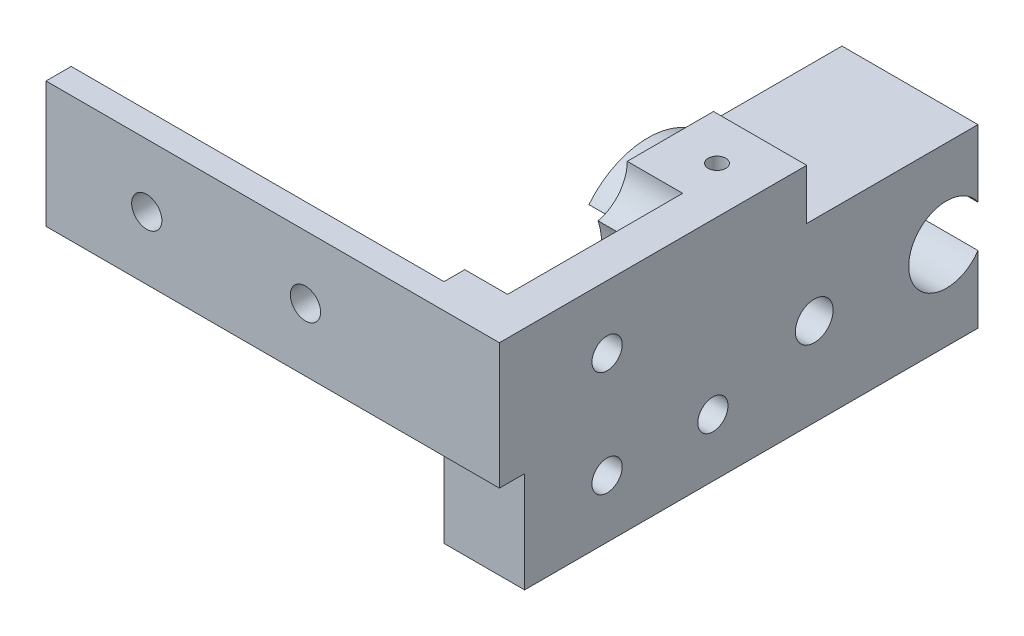
from build123d import *

# Parameters (mm, degrees)
SKETCH_1_W           = 18
SKETCH_1_H           = 9
EXTRUDE_1_DEPTH      = 8.3
SKETCH_1_12_R        = 3.5
CUT_EXTRUDE_1_DEPTH  = 6.8
SKETCH_1_14_R        = 3.5
CUT_EXTRUDE_2_DEPTH  = 5.1
SKETCH_1_15_R        = 3.5
CUT_EXTRUDE_3_DEPTH  = 3.4
SKETCH_1_16_R        = 4
CUT_EXTRUDE_4_DEPTH  = 1.7
CUT_EXTRUDE_5_DEPTH  = 5.1
CUT_EXTRUDE_6_DEPTH  = 2.9
CUT_EXTRUDE_7_DEPTH  = 1.2
SKETCH_3_W           = 5.4
SKETCH_3_H           = 6.8
CUT_EXTRUDE_8_DEPTH  = 2
SKETCH_1_19_R        = 1.5
CUT_EXTRUDE_9_DEPTH  = 6.8
CUT_EXTRUDE_10_DEPTH = 1.7
CUT_EXTRUDE_11_DEPTH = 1.2
CUT_EXTRUDE_START    = 0.5
CUT_EXTRUDE_13_DEPTH = 1.2
CUT_EXTRUDE_START_2  = 6.8
SKETCH_1_20_R        = 0.6
CUT_EXTRUDE_14_DEPTH = 15.969014677
CUT_EXTRUDE_START_3  = 1.7
SKETCH_1_21_R        = 0.75
SKETCH_1_21_R_2      = 0.6
CUT_EXTRUDE_15_DEPTH = 21.069014677
SKETCH_6_R           = 0.6
CUT_EXTRUDE_16_DEPTH = 22.179235114
SKETCH_6_3_R         = 1.5
CUT_EXTRUDE_17_DEPTH = 3.4
SKETCH_7_W           = 18
SKETCH_7_H           = 5
SKETCH_7_R           = 0.6
EXTRUDE_2_DEPTH      = 1
SKETCH_8_R           = 0.35
CUT_EXTRUDE_18_DEPTH = 2


with BuildPart() as part:
    # 草图1 → 凸台-拉伸1 (new body)
    with BuildSketch(Plane(origin=(0, 0, 0), x_dir=(0, 0, -1), z_dir=(1, 0, 0))):
        with Locations((-9, -4.5)):
            Rectangle(SKETCH_1_W, SKETCH_1_H)
    extrude(amount=EXTRUDE_1_DEPTH)

    # 草图1<12> → 切除-拉伸1 (cut)
    with BuildSketch(Plane(origin=(0, 0, 0), x_dir=(0, 0, -1), z_dir=(1, 0, 0))):
        with Locations((-14.724922359, -2.5)):
            Circle(SKETCH_1_12_R)
    extrude(amount=CUT_EXTRUDE_1_DEPTH, mode=Mode.SUBTRACT)

    # 草图1<14> → 切除-拉伸2 (cut)
    with BuildSketch(Plane(origin=(0, 0, 0), x_dir=(0, 0, -1), z_dir=(1, 0, 0))):
        with Locations((-14.724922359, -6.7)):
            Circle(SKETCH_1_14_R)
    extrude(amount=CUT_EXTRUDE_2_DEPTH, mode=Mode.SUBTRACT)

    # 草图1<15> → 切除-拉伸3 (cut)
    with BuildSketch(Plane(origin=(0, 0, 0), x_dir=(0, 0, -1), z_dir=(1, 0, 0))):
        with Locations((-10.524922359, -6.7)):
            Circle(SKETCH_1_15_R)
    extrude(amount=CUT_EXTRUDE_3_DEPTH, mode=Mode.SUBTRACT)

    # 草图1<16> → 切除-拉伸4 (cut)
    with BuildSketch(Plane(origin=(0, 0, 0), x_dir=(0, 0, -1), z_dir=(1, 0, 0))):
        with Locations((-6.5, -5.5)):
            Circle(SKETCH_1_16_R)
    extrude(amount=CUT_EXTRUDE_4_DEPTH, mode=Mode.SUBTRACT)

    # 草图1<17> → 切除-拉伸5 (cut)
    with BuildSketch(Plane(origin=(0, 0, 0), x_dir=(0, 0, -1), z_dir=(1, 0, 0))):
        with BuildLine():
            Line((-18, -9), (-17.363103551, -9))
            ThreePointArc((-17.363103551, -9), (-17.729170482, -8.495687395), (-18, -7.934449857))
            Line((-18, -7.934449857), (-18, -9))
        make_face()
        with BuildLine():
            ThreePointArc((-17.524922359, -4.6), (-17.793136229, -4.184061654), (-18, -3.734449857))
            Line((-18, -3.734449857), (-18, -5.465550143))
            ThreePointArc((-18, -5.465550143), (-17.793136229, -5.015938346), (-17.524922359, -4.6))
        make_face()
        with BuildLine():
            ThreePointArc((-18, -1.265550143), (-17.656316605, -0.58769046), (-17.174412102, 0))
            Line((-17.174412102, 0), (-18, 0))
            Line((-18, 0), (-18, -1.265550143))
        make_face()
    extrude(amount=CUT_EXTRUDE_5_DEPTH, mode=Mode.SUBTRACT)

    # 草图1<18> → 切除-拉伸6 (cut)
    with BuildSketch(Plane(origin=(0, 0, 0), x_dir=(0, 0, -1), z_dir=(1, 0, 0))):
        with BuildLine():
            Line((0, -9), (0, 0))
            Line((0, 0), (-8.624932715, 0))
            ThreePointArc((-8.624932715, 0), (-8.624924948, -0.004006417), (-8.624922359, -0.008012841))
            ThreePointArc((-8.624922359, -0.008012841), (-9.378363691, -2.033762682), (-11.272446499, -3.074813388))
            ThreePointArc((-11.272446499, -3.074813388), (-11.292201209, -3.182953516), (-11.315342274, -3.290419915))
            ThreePointArc((-11.315342274, -3.290419915), (-10.569517592, -3.200284116), (-9.821638329, -3.271386348))
            ThreePointArc((-9.821638329, -3.271386348), (-5.335215324, -1.673346546), (-2.5, -5.5))
            ThreePointArc((-2.5, -5.5), (-3.054280431, -7.531506006), (-4.563508327, -9))
            Line((-4.563508327, -9), (0, -9))
        make_face()
        with BuildLine():
            ThreePointArc((-8.624922359, -0.008012841), (-8.624924948, -0.004006417), (-8.624932715, 0))
            Line((-8.624932715, 0), (-10.224943762, 0))
            ThreePointArc((-10.224943762, 0), (-10.22492771, -0.004006406), (-10.224922359, -0.008012841))
            ThreePointArc((-10.224922359, -0.008012841), (-10.548791645, -0.938988964), (-11.380544415, -1.467945659))
            ThreePointArc((-11.380544415, -1.467945659), (-11.264046545, -1.978139294), (-11.224922359, -2.5))
            ThreePointArc((-11.224922359, -2.5), (-11.236823629, -2.788387316), (-11.272446499, -3.074813388))
            ThreePointArc((-11.272446499, -3.074813388), (-9.378363691, -2.033762682), (-8.624922359, -0.008012841))
        make_face()
        with BuildLine():
            Line((-10.224943762, 0), (-8.624932715, 0))
            ThreePointArc((-8.624932715, 0), (-11.218224886, 3.050296769), (-14.656688161, 0.999334807))
            ThreePointArc((-14.656688161, 0.999334807), (-13.853421855, 0.889762067), (-13.096913716, 0.598320167))
            ThreePointArc((-13.096913716, 0.598320167), (-11.418994363, 1.460458494), (-10.224943762, 0))
        make_face()
        with BuildLine():
            ThreePointArc((-13.096913716, 0.598320167), (-13.853421855, 0.889762067), (-14.656688161, 0.999334807))
            ThreePointArc((-14.656688161, 0.999334807), (-14.781912048, 0.50658802), (-14.824912004, 0))
            Line((-14.824912004, 0), (-13.224900957, 0))
            ThreePointArc((-13.224900957, 0), (-13.191738507, 0.305755209), (-13.096913716, 0.598320167))
        make_face()
        with BuildLine():
            ThreePointArc((-10.224922359, -0.008012841), (-10.22492771, -0.004006406), (-10.224943762, 0))
            Line((-10.224943762, 0), (-12.275432617, 0))
            ThreePointArc((-12.275432617, 0), (-11.736454222, -0.678171745), (-11.380544415, -1.467945659))
            ThreePointArc((-11.380544415, -1.467945659), (-10.548791645, -0.938988964), (-10.224922359, -0.008012841))
        make_face()
        with BuildLine():
            Line((-12.275432617, 0), (-10.224943762, 0))
            ThreePointArc((-10.224943762, 0), (-11.418994363, 1.460458494), (-13.096913716, 0.598320167))
            ThreePointArc((-13.096913716, 0.598320167), (-12.664341124, 0.329135022), (-12.275432617, 0))
        make_face()
        with BuildLine():
            ThreePointArc((-11.380544415, -1.467945659), (-11.736454222, -0.678171745), (-12.275432617, 0))
            Line((-12.275432617, 0), (-13.224900957, 0))
            ThreePointArc((-13.224900957, 0), (-12.659036556, -1.181652764), (-11.380544415, -1.467945659))
        make_face()
        with BuildLine():
            Line((-13.224900957, 0), (-12.275432617, 0))
            ThreePointArc((-12.275432617, 0), (-12.664341124, 0.329135022), (-13.096913716, 0.598320167))
            ThreePointArc((-13.096913716, 0.598320167), (-13.191738507, 0.305755209), (-13.224900957, 0))
        make_face()
    extrude(amount=CUT_EXTRUDE_6_DEPTH, mode=Mode.SUBTRACT)

    # 草图2 → 切除-拉伸7 (cut)
    with BuildSketch(Plane.ZY.offset(-1.7)):
        with BuildLine():
            ThreePointArc((6.5, -9), (3.374181267, -3.925434267), (9.31246118, -3.416718427))
            ThreePointArc((9.31246118, -3.416718427), (9.564297417, -3.334409455), (9.821638329, -3.271386348))
            ThreePointArc((9.821638329, -3.271386348), (3.553152293, -2.795173094), (4.563508327, -9))
            Line((4.563508327, -9), (6.5, -9))
        make_face()
    extrude(amount=-CUT_EXTRUDE_7_DEPTH, mode=Mode.SUBTRACT)

    # 草图3 → 切除-拉伸8 (cut)
    with BuildSketch(Plane(origin=(0, 0, 0), x_dir=(1, 0, 0), z_dir=(0, 1, 0))):
        with Locations((5.6, -3.4)):
            Rectangle(SKETCH_3_W, SKETCH_3_H)
    extrude(amount=-CUT_EXTRUDE_8_DEPTH, mode=Mode.SUBTRACT)

    # 草图1<19> → 切除-拉伸9 (cut)
    with BuildSketch(Plane(origin=(0, 0, 0), x_dir=(0, 0, -1), z_dir=(1, 0, 0))):
        with Locations((-11.724922359, -0.008012841)):
            Circle(SKETCH_1_19_R)
    extrude(amount=CUT_EXTRUDE_9_DEPTH, mode=Mode.SUBTRACT)

    # 草图4 → 切除-拉伸10 (cut)
    with BuildSketch(Plane.ZY.offset(-2.9)):
        with BuildLine():
            Line((10.224943762, 0), (6.8, 0))
            Line((6.8, 0), (6.8, -2))
            Line((6.8, -2), (6.5, -2))
            ThreePointArc((6.5, -2), (8.074565733, -2.374181267), (9.31246118, -3.416718427))
            ThreePointArc((9.31246118, -3.416718427), (10.304655394, -3.206937953), (11.315342274, -3.290419915))
            ThreePointArc((11.315342274, -3.290419915), (11.227160165, -2.374861561), (11.380544415, -1.467945659))
            ThreePointArc((11.380544415, -1.467945659), (10.546309243, -0.935844249), (10.224943762, 0))
        make_face()
    extrude(amount=-CUT_EXTRUDE_10_DEPTH, mode=Mode.SUBTRACT)

    # 草图5 → 切除-拉伸11 (cut)
    with BuildSketch(Plane.ZY.offset(-3.4)):
        with BuildLine():
            ThreePointArc((11.315342274, -3.290419915), (10.304655394, -3.206937953), (9.31246118, -3.416718427))
            ThreePointArc((9.31246118, -3.416718427), (9.45763616, -3.628533104), (9.58689031, -3.850421808))
            ThreePointArc((9.58689031, -3.850421808), (10.545192403, -3.70006848), (11.501375265, -3.863357667))
            ThreePointArc((11.501375265, -3.863357667), (11.396009855, -3.580898486), (11.315342274, -3.290419915))
        make_face()
    extrude(amount=-CUT_EXTRUDE_11_DEPTH, mode=Mode.SUBTRACT)

    # 草图5<4> → 切除-拉伸13 (cut)
    with BuildSketch(Plane.ZY.offset(-3.4).offset(CUT_EXTRUDE_START)):
        with BuildLine():
            ThreePointArc((9.31246118, -3.416718427), (3.374181267, -3.925434267), (6.5, -9))
            ThreePointArc((6.5, -9), (7.115838654, -8.945394426), (7.71246118, -8.783281573))
            ThreePointArc((7.71246118, -8.783281573), (7.567286199, -8.571466896), (7.438032049, -8.349578192))
            ThreePointArc((7.438032049, -8.349578192), (3.625055458, -4.642857143), (8.845337154, -3.629333372))
            ThreePointArc((8.845337154, -3.629333372), (9.074996723, -3.514452065), (9.31246118, -3.416718427))
        make_face()
        with BuildLine():
            ThreePointArc((7.71246118, -8.783281573), (7.115838654, -8.945394426), (6.5, -9))
            Line((6.5, -9), (7.886741168, -9))
            ThreePointArc((7.886741168, -9), (7.797447835, -8.893372453), (7.71246118, -8.783281573))
        make_face()
    extrude(amount=CUT_EXTRUDE_13_DEPTH, mode=Mode.SUBTRACT)

    # 草图1<20> → 切除-拉伸14 (cut, through all)
    with BuildSketch(Plane(origin=(0, 0, 0), x_dir=(0, 0, -1), z_dir=(1, 0, 0)).offset(CUT_EXTRUDE_START_2)):
        with Locations((-14.724922359, -2.5)):
            Circle(SKETCH_1_20_R)
    extrude(amount=CUT_EXTRUDE_14_DEPTH, mode=Mode.SUBTRACT)

    # 草图1<21> → 切除-拉伸15 (cut, through all)
    with BuildSketch(Plane(origin=(0, 0, 0), x_dir=(0, 0, -1), z_dir=(1, 0, 0)).offset(CUT_EXTRUDE_START_3)):
        with Locations(Location((-6.5, -5.5, 0), (0, 0, 177.482710398))):
            Circle(SKETCH_1_21_R)
        with Locations((-14.724922359, -6.7)):
            Circle(SKETCH_1_21_R_2)
        with Locations((-10.524922359, -6.7)):
            Circle(SKETCH_1_21_R_2)
    extrude(amount=CUT_EXTRUDE_15_DEPTH, mode=Mode.SUBTRACT)

    # 草图6 → 切除-拉伸16 (cut, through all)
    with BuildSketch(Plane(origin=(8.3, 0, 0), x_dir=(0, 0, -1), z_dir=(1, 0, 0))):
        with Locations((-1.25, -5.5)):
            Circle(SKETCH_6_R)
    extrude(amount=-CUT_EXTRUDE_16_DEPTH, mode=Mode.SUBTRACT)

    # 草图6<3> → 切除-拉伸17 (cut)
    with BuildSketch(Plane(origin=(8.3, 0, 0), x_dir=(0, 0, -1), z_dir=(1, 0, 0))):
        with Locations((-1.25, -5.5)):
            Circle(SKETCH_6_3_R)
    extrude(amount=-CUT_EXTRUDE_17_DEPTH, mode=Mode.SUBTRACT)

    # 草图7 → 凸台-拉伸2 (add)
    with BuildSketch(Plane.XY.offset(18)):
        with Locations((-0.7, -2.5)):
            Rectangle(SKETCH_7_W, SKETCH_7_H)
        with Locations((-5.7, -2.5)):
            Circle(SKETCH_7_R, mode=Mode.SUBTRACT)
        with Locations((0.6, -2.5)):
            Circle(SKETCH_7_R, mode=Mode.SUBTRACT)
    extrude(amount=EXTRUDE_2_DEPTH)

    # 草图8 → 切除-拉伸18 (cut)
    with BuildSketch(Plane(origin=(0, 0, 0), x_dir=(1, 0, 0), z_dir=(0, 1, 0))):
        with Locations(Location((6.45, -8.512471881, 0), (0, 0, 270))):
            Circle(SKETCH_8_R)
    extrude(amount=-CUT_EXTRUDE_18_DEPTH, mode=Mode.SUBTRACT)


solid = part.part
